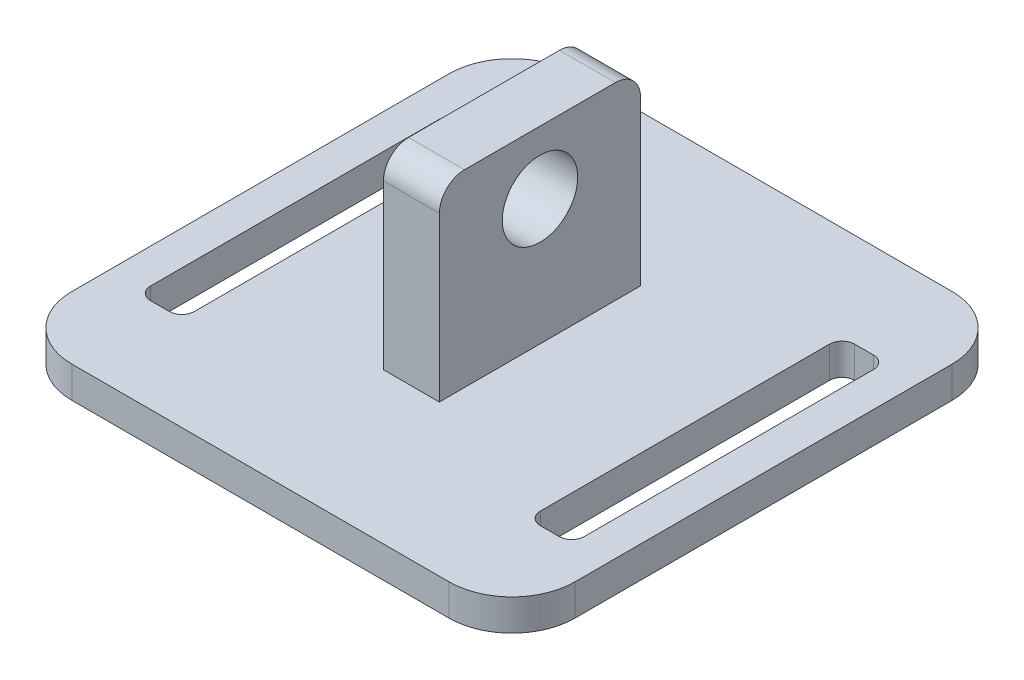
from build123d import *

# Parameters (mm, degrees)
SKETCH1_W               = 3.5
SKETCH1_H               = 25
BOSS_EXTRUDE1_DEPTH     = 2.5
FILLET1_R               = 1
FILLET2_R               = 1
SKETCH2_W               = 4.45
SKETCH2_H               = 16
BOSS_EXTRUDE2_DEPTH     = 15
CUT_EXTRUDE1_DEPTH      = 35.643911803
CUT_EXTRUDE1_DEPTH_BACK = 35.643911803
SKETCH3_R               = 3
FILLET3_R               = 2


with BuildPart() as part:
    # Sketch1 → Boss-Extrude1 (new body)
    with BuildSketch(Plane(origin=(0, 0, 0), x_dir=(1, 0, 0), z_dir=(0, 1, 0))):
        with BuildLine():
            Line((15, 20), (-15, 20))
            ThreePointArc((-15, 20), (-18.535533906, 18.535533906), (-20, 15))
            Line((-20, 15), (-20, -15))
            ThreePointArc((-20, -15), (-18.535533906, -18.535533906), (-15, -20))
            Line((-15, -20), (15, -20))
            ThreePointArc((15, -20), (18.535533906, -18.535533906), (20, -15))
            Line((20, -15), (20, 15))
            ThreePointArc((20, 15), (18.535533906, 18.535533906), (15, 20))
        make_face()
        with Locations((-15.5, 0)):
            Rectangle(SKETCH1_W, SKETCH1_H, mode=Mode.SUBTRACT)
        with Locations((15.5, 0)):
            Rectangle(SKETCH1_W, SKETCH1_H, mode=Mode.SUBTRACT)
    extrude(amount=BOSS_EXTRUDE1_DEPTH)

    # Fillet1
    fillet1_edges = [part.edges().sort_by_distance(p)[0] for p in [
        (-17.25, 1.25, -12.5),
        (-17.25, 1.25, 12.5),
        (-13.75, 1.25, 12.5),
        (-13.75, 1.25, -12.5),
    ]]
    fillet(fillet1_edges, radius=FILLET1_R)

    # Fillet2
    fillet2_edges = [part.edges().sort_by_distance(p)[0] for p in [
        (13.75, 1.25, -12.5),
        (13.75, 1.25, 12.5),
        (17.25, 1.25, 12.5),
        (17.25, 1.25, -12.5),
    ]]
    fillet(fillet2_edges, radius=FILLET2_R)

    # Sketch2 → Boss-Extrude2 (add)
    with BuildSketch(Plane(origin=(0, 2.5, 0), x_dir=(1, 0, 0), z_dir=(0, 1, 0))):
        Rectangle(SKETCH2_W, SKETCH2_H)
    extrude(amount=BOSS_EXTRUDE2_DEPTH)

    # Sketch3 → Cut-Extrude1 (cut, two sides: drawn at the far end of the back side and taken through both)
    with BuildSketch(Plane.ZY.offset(2.225).offset(-CUT_EXTRUDE1_DEPTH_BACK)):
        with Locations((0, 12.5)):
            Circle(SKETCH3_R)
    extrude(amount=CUT_EXTRUDE1_DEPTH + CUT_EXTRUDE1_DEPTH_BACK, mode=Mode.SUBTRACT)

    # Fillet3
    fillet3_edges = [part.edges().sort_by_distance(p)[0] for p in [
        (0, 17.5, 8),
        (0, 17.5, -8),
    ]]
    fillet(fillet3_edges, radius=FILLET3_R)


solid = part.part
